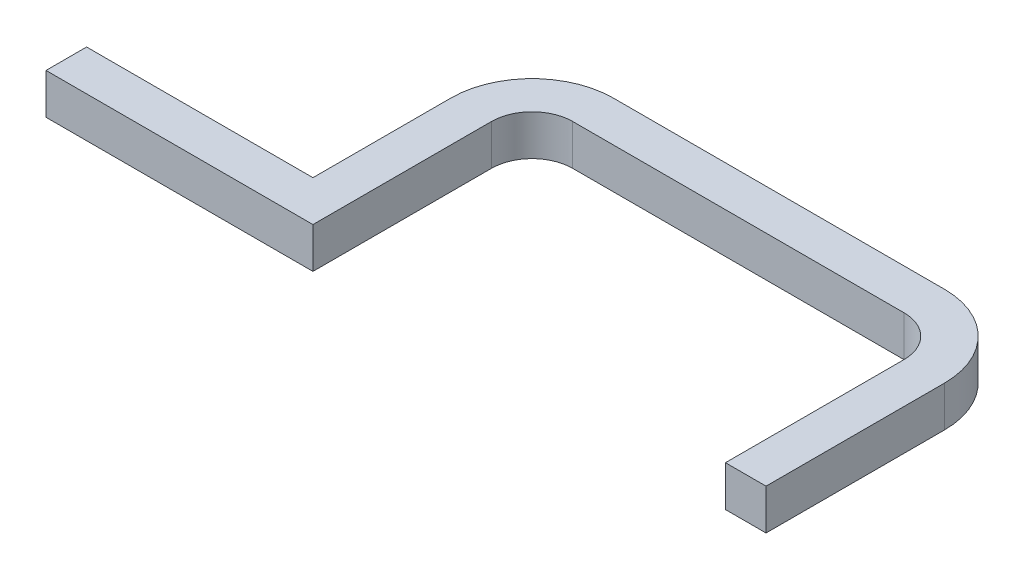
from build123d import *

# Parameters (mm, degrees)
BOSS_EXTRUDE1_DEPTH = 10


with BuildPart() as part:
    # Sketch1 → Boss-Extrude1 (new body)
    with BuildSketch(Plane(origin=(0, 0, 0), x_dir=(1, 0, 0), z_dir=(0, 1, 0))):
        with BuildLine():
            Line((0, 0), (29.149551568, 0))
            Line((29.149551568, 0), (29.149551568, 43.975))
            ThreePointArc((29.149551568, 43.975), (32.078483756, 51.046067812), (39.149551568, 53.975))
            Line((39.149551568, 53.975), (120.749551568, 53.975))
            ThreePointArc((120.749551568, 53.975), (127.82061938, 51.046067812), (130.749551568, 43.975))
            Line((130.749551568, 43.975), (130.749551568, 0))
            Line((130.749551568, 0), (140.749551568, 0))
            Line((140.749551568, 0), (140.749551568, 43.975))
            ThreePointArc((140.749551568, 43.975), (134.891687192, 58.117135624), (120.749551568, 63.975))
            Line((120.749551568, 63.975), (39.149551568, 63.975))
            ThreePointArc((39.149551568, 63.975), (25.007415944, 58.117135624), (19.149551568, 43.975))
            Line((19.149551568, 43.975), (19.149551568, 10))
            Line((19.149551568, 10), (0, 10))
            Line((0, 10), (-36.600725287, 10))
            Line((-36.600725287, 10), (-36.600725287, 0))
            Line((-36.600725287, 0), (0, 0))
        make_face()
    extrude(amount=BOSS_EXTRUDE1_DEPTH)


solid = part.part
